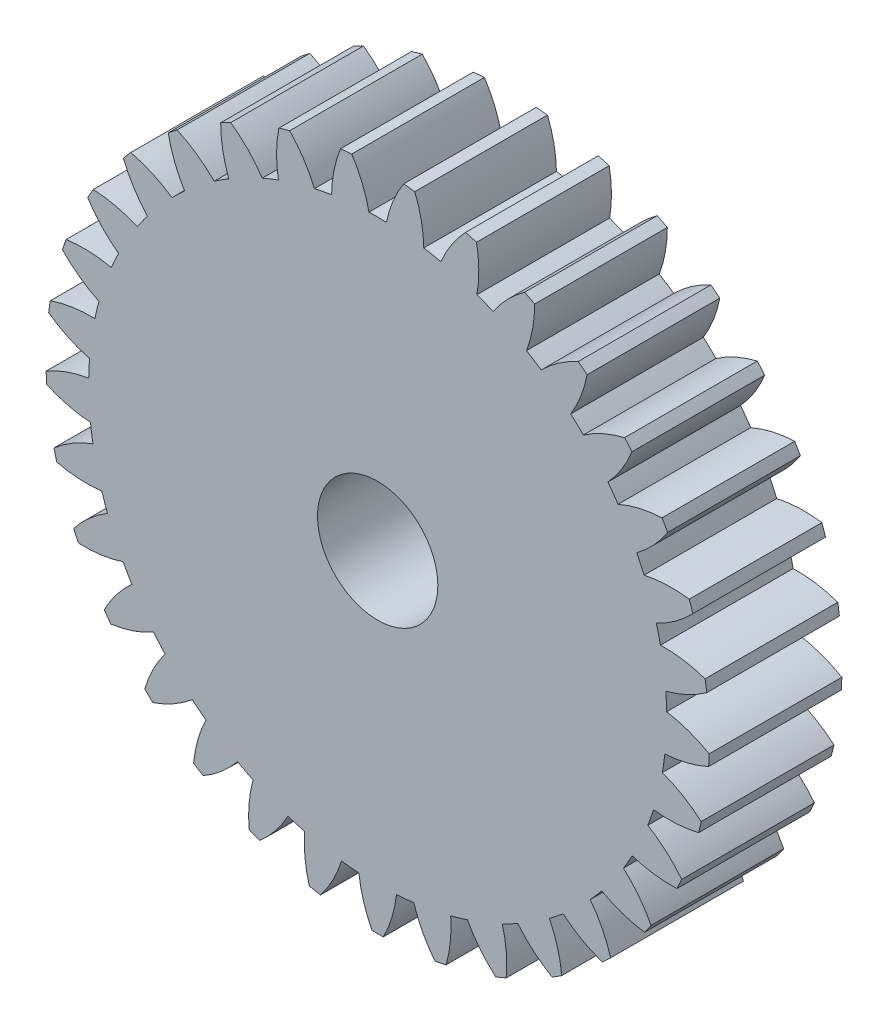
from build123d import *

# Parameters (mm, degrees)
CROQUIS1_R              = 3.175
SALIENTE_EXTRUIR1_DEPTH = 7


with BuildPart() as part:
    # Croquis1 → Saliente-Extruir1 (new body)
    with BuildSketch(Plane.XY):
        with BuildLine():
            ThreePointArc((2.432853295, 15.05367815), (2.30290802, 16.243278252), (1.96029505, 17.389860359))
            ThreePointArc((1.96029505, 17.389860359), (1.663480758, 17.420758645), (1.366182748, 17.446591206))
            ThreePointArc((1.366182748, 17.446591206), (0.812769149, 16.385569262), (0.460038855, 15.242059088))
            ThreePointArc((0.460038855, 15.242059088), (0, 15.249), (-0.460038855, 15.242059088))
            ThreePointArc((-0.460038855, 15.242059088), (-0.812769149, 16.385569262), (-1.366182748, 17.446591206))
            ThreePointArc((-1.366182748, 17.446591206), (-1.663480758, 17.420758645), (-1.96029505, 17.389860359))
            ThreePointArc((-1.96029505, 17.389860359), (-2.30290802, 16.243278252), (-2.432853295, 15.05367815))
            ThreePointArc((-2.432853295, 15.05367815), (-2.885892225, 14.973430705), (-3.336304003, 14.879552298))
            ThreePointArc((-3.336304003, 14.879552298), (-3.899070724, 15.935643106), (-4.643283141, 16.872756789))
            ThreePointArc((-4.643283141, 16.872756789), (-4.930319745, 16.791127038), (-5.215922677, 16.704614651))
            ThreePointArc((-5.215922677, 16.704614651), (-5.335352094, 15.513912845), (-5.237815789, 14.321218061))
            ThreePointArc((-5.237815789, 14.321218061), (-5.667480786, 14.156682611), (-6.091986431, 13.97925972))
            ThreePointArc((-6.091986431, 13.97925972), (-6.844449724, 14.909761289), (-7.752563184, 15.689096981))
            ThreePointArc((-7.752563184, 15.689096981), (-8.01896413, 15.554620351), (-8.283033268, 15.415620645))
            ThreePointArc((-8.283033268, 15.415620645), (-8.174962642, 14.223834206), (-7.853469973, 13.071151838))
            ThreePointArc((-7.853469973, 13.071151838), (-8.244231825, 12.828275122), (-8.627488597, 12.573720273))
            ThreePointArc((-8.627488597, 12.573720273), (-9.542452478, 13.345001851), (-10.581645394, 13.93839233))
            ThreePointArc((-10.581645394, 13.93839233), (-10.817782259, 13.755929158), (-11.050773456, 13.569465945))
            ThreePointArc((-11.050773456, 13.569465945), (-10.71910874, 12.41966914), (-10.18527929, 11.348660131))
            ThreePointArc((-10.18527929, 11.348660131), (-10.523014846, 11.036220347), (-10.851170847, 10.713733815))
            ThreePointArc((-10.851170847, 10.713733815), (-11.895566137, 11.297919277), (-13.02827937, 11.683917864))
            ThreePointArc((-13.02827937, 11.683917864), (-13.225617551, 11.460062844), (-13.419109899, 11.23287539))
            ThreePointArc((-13.419109899, 11.23287539), (-12.87583832, 10.166624871), (-12.148966076, 9.215998279))
            ThreePointArc((-12.148966076, 9.215998279), (-12.421468693, 8.845287814), (-12.68266351, 8.466525102))
            ThreePointArc((-12.68266351, 8.466525102), (-13.818743042, 8.842500464), (-15.004037384, 9.007156165))
            ThreePointArc((-15.004037384, 9.007156165), (-15.155444566, 8.75), (-15.302444747, 8.490299451))
            ThreePointArc((-15.302444747, 8.490299451), (-14.567201556, 7.546132291), (-13.673557575, 6.750246236))
            ThreePointArc((-13.673557575, 6.750246236), (-13.870978297, 6.334663533), (-14.055771669, 5.913314113))
            ThreePointArc((-14.055771669, 5.913314113), (-15.242474569, 6.067490645), (-16.437510395, 6.004852374))
            ThreePointArc((-16.437510395, 6.004852374), (-16.537514328, 5.723689358), (-16.632709371, 5.44086197))
            ThreePointArc((-16.632709371, 5.44086197), (-15.732068173, 4.652902829), (-14.703951076, 4.040522707))
            ThreePointArc((-14.703951076, 4.040522707), (-14.819154605, 3.595088008), (-14.920867618, 3.146380544))
            ThreePointArc((-14.920867618, 3.146380544), (-16.115303351, 3.073185905), (-17.276888952, 2.785517572))
            ThreePointArc((-17.276888952, 2.785517572), (-17.321875233, 2.49050967), (-17.361824543, 2.19477756))
            ThreePointArc((-17.361824543, 2.19477756), (-16.328336856, 1.591505335), (-15.202905475, 1.18476416))
            ThreePointArc((-15.202905475, 1.18476416), (-15.231728055, 0.725576634), (-15.246684535, 0.265728585))
            ThreePointArc((-15.246684535, 0.265728585), (-16.405683083, -0.03219178), (-17.491835728, -0.534493092))
            ThreePointArc((-17.491835728, -0.534493092), (-17.480178436, -0.832683527), (-17.46343814, -1.130631829))
            ThreePointArc((-17.46343814, -1.130631829), (-16.334456903, -1.527413308), (-15.152387259, -1.713814851))
            ThreePointArc((-15.152387259, -1.713814851), (-15.093787167, -2.170158969), (-15.021446549, -2.624527497))
            ThreePointArc((-15.021446549, -2.624527497), (-16.103118683, -3.136405971), (-17.074581986, -3.835185783))
            ThreePointArc((-17.074581986, -3.835185783), (-17.006702446, -4.125781371), (-16.933877582, -4.415177237))
            ThreePointArc((-16.933877582, -4.415177237), (-15.750207118, -4.591127255), (-14.554222289, -4.550452128))
            ThreePointArc((-14.554222289, -4.550452128), (-14.410317485, -4.987459373), (-14.253294346, -5.419926318))
            ThreePointArc((-14.253294346, -5.419926318), (-15.218545617, -6.127262278), (-16.040208364, -6.997264868))
            ThreePointArc((-16.040208364, -6.997264868), (-15.918559919, -7.269762728), (-15.792282567, -7.540146637))
            ThreePointArc((-15.792282567, -7.540146637), (-14.596703811, -7.4889059), (-13.430029804, -7.222624209))
            ThreePointArc((-13.430029804, -7.222624209), (-13.206021382, -7.6245), (-12.969990949, -8.01943488))
            ThreePointArc((-12.969990949, -8.01943488), (-13.783934661, -8.896663362), (-14.42609982, -9.906444569))
            ThreePointArc((-14.42609982, -9.906444569), (-14.255079161, -10.150995918), (-14.079913315, -10.392595492))
            ThreePointArc((-14.079913315, -10.392595492), (-12.915637597, -10.116015974), (-11.820441051, -9.633751832))
            ThreePointArc((-11.820441051, -9.633751832), (-11.524425259, -9.985971332), (-11.217918286, -10.32910017))
            ThreePointArc((-11.217918286, -10.32910017), (-11.851136393, -11.344515851), (-12.290594441, -12.457579552))
            ThreePointArc((-12.290594441, -12.457579552), (-12.076382701, -12.665345667), (-11.85865931, -12.869428868))
            ThreePointArc((-11.85865931, -12.869428868), (-10.767766589, -12.377506874), (-9.78363076, -11.696690564))
            ThreePointArc((-9.78363076, -11.696690564), (-9.426306381, -11.986523642), (-9.060400828, -12.265444869))
            ThreePointArc((-9.060400828, -12.265444869), (-9.490007178, -13.382347981), (-9.710874956, -14.558465152))
            ThreePointArc((-9.710874956, -14.558465152), (-9.461214305, -14.721936825), (-9.20880246, -14.881127553))
            ThreePointArc((-9.20880246, -14.881127553), (-8.230720441, -14.191642426), (-7.393214562, -13.336880424))
            ThreePointArc((-7.393214562, -13.336880424), (-6.98749623, -13.553851757), (-6.575416878, -13.758484433))
            ThreePointArc((-6.575416878, -13.758484433), (-6.785884378, -14.936507186), (-6.780179149, -16.13316989))
            ThreePointArc((-6.780179149, -16.13316989), (-6.504092974, -16.246438828), (-6.226115496, -16.354983517))
            ThreePointArc((-6.226115496, -16.354983517), (-5.396194611, -15.492855045), (-4.735588328, -14.495040676))
            ThreePointArc((-4.735588328, -14.495040676), (-4.296139759, -14.631308355), (-3.852780229, -14.754256522))
            ThreePointArc((-3.852780229, -14.754256522), (-3.836502035, -15.950822106), (-3.604430001, -17.124779834))
            ThreePointArc((-3.604430001, -17.124779834), (-3.311896776, -17.183752202), (-3.018400496, -17.237727764))
            ThreePointArc((-3.018400496, -17.237727764), (-2.366636249, -16.234115516), (-1.906805592, -15.129312391))
            ThreePointArc((-1.906805592, -15.129312391), (-1.449509604, -15.179951347), (-0.990894065, -15.216771338))
            ThreePointArc((-0.990894065, -15.216771338), (-0.748458514, -16.388632755), (-0.298407363, -17.497455616))
            ThreePointArc((-0.298407363, -17.497455616), (0, -17.5), (0.298407363, -17.497455616))
            ThreePointArc((0.298407363, -17.497455616), (0.748458514, -16.388632755), (0.990894065, -15.216771338))
            ThreePointArc((0.990894065, -15.216771338), (1.449509604, -15.179951347), (1.906805592, -15.129312391))
            ThreePointArc((1.906805592, -15.129312391), (2.366636249, -16.234115516), (3.018400496, -17.237727764))
            ThreePointArc((3.018400496, -17.237727764), (3.311896776, -17.183752202), (3.604430001, -17.124779834))
            ThreePointArc((3.604430001, -17.124779834), (3.836502035, -15.950822106), (3.852780229, -14.754256522))
            ThreePointArc((3.852780229, -14.754256522), (4.296139759, -14.631308355), (4.735588328, -14.495040676))
            ThreePointArc((4.735588328, -14.495040676), (5.396194611, -15.492855045), (6.226115496, -16.354983517))
            ThreePointArc((6.226115496, -16.354983517), (6.504092974, -16.246438828), (6.780179149, -16.13316989))
            ThreePointArc((6.780179149, -16.13316989), (6.785884378, -14.936507186), (6.575416878, -13.758484433))
            ThreePointArc((6.575416878, -13.758484433), (6.98749623, -13.553851757), (7.393214562, -13.336880424))
            ThreePointArc((7.393214562, -13.336880424), (8.230720441, -14.191642426), (9.20880246, -14.881127553))
            ThreePointArc((9.20880246, -14.881127553), (9.461214305, -14.721936825), (9.710874956, -14.558465152))
            ThreePointArc((9.710874956, -14.558465152), (9.490007178, -13.382347981), (9.060400828, -12.265444869))
            ThreePointArc((9.060400828, -12.265444869), (9.426306381, -11.986523642), (9.78363076, -11.696690564))
            ThreePointArc((9.78363076, -11.696690564), (10.767766589, -12.377506874), (11.85865931, -12.869428868))
            ThreePointArc((11.85865931, -12.869428868), (12.076382701, -12.665345667), (12.290594441, -12.457579552))
            ThreePointArc((12.290594441, -12.457579552), (11.851136393, -11.344515851), (11.217918286, -10.32910017))
            ThreePointArc((11.217918286, -10.32910017), (11.524425259, -9.985971332), (11.820441051, -9.633751832))
            ThreePointArc((11.820441051, -9.633751832), (12.915637597, -10.116015974), (14.079913315, -10.392595492))
            ThreePointArc((14.079913315, -10.392595492), (14.255079161, -10.150995918), (14.42609982, -9.906444569))
            ThreePointArc((14.42609982, -9.906444569), (13.783934661, -8.896663362), (12.969990949, -8.01943488))
            ThreePointArc((12.969990949, -8.01943488), (13.206021382, -7.6245), (13.430029804, -7.222624209))
            ThreePointArc((13.430029804, -7.222624209), (14.596703811, -7.4889059), (15.792282567, -7.540146637))
            ThreePointArc((15.792282567, -7.540146637), (15.918559919, -7.269762728), (16.040208364, -6.997264868))
            ThreePointArc((16.040208364, -6.997264868), (15.218545617, -6.127262278), (14.253294346, -5.419926318))
            ThreePointArc((14.253294346, -5.419926318), (14.410317485, -4.987459373), (14.554222289, -4.550452128))
            ThreePointArc((14.554222289, -4.550452128), (15.750207118, -4.591127255), (16.933877582, -4.415177237))
            ThreePointArc((16.933877582, -4.415177237), (17.006702446, -4.125781371), (17.074581986, -3.835185783))
            ThreePointArc((17.074581986, -3.835185783), (16.103118683, -3.136405971), (15.021446549, -2.624527497))
            ThreePointArc((15.021446549, -2.624527497), (15.093787167, -2.170158969), (15.152387259, -1.713814851))
            ThreePointArc((15.152387259, -1.713814851), (16.334456903, -1.527413308), (17.46343814, -1.130631829))
            ThreePointArc((17.46343814, -1.130631829), (17.480178436, -0.832683527), (17.491835728, -0.534493092))
            ThreePointArc((17.491835728, -0.534493092), (16.405683083, -0.03219178), (15.246684535, 0.265728585))
            ThreePointArc((15.246684535, 0.265728585), (15.231728055, 0.725576634), (15.202905475, 1.18476416))
            ThreePointArc((15.202905475, 1.18476416), (16.328336856, 1.591505335), (17.361824543, 2.19477756))
            ThreePointArc((17.361824543, 2.19477756), (17.321875233, 2.49050967), (17.276888952, 2.785517572))
            ThreePointArc((17.276888952, 2.785517572), (16.115303351, 3.073185905), (14.920867618, 3.146380544))
            ThreePointArc((14.920867618, 3.146380544), (14.819154605, 3.595088008), (14.703951076, 4.040522707))
            ThreePointArc((14.703951076, 4.040522707), (15.732068173, 4.652902829), (16.632709371, 5.44086197))
            ThreePointArc((16.632709371, 5.44086197), (16.537514328, 5.723689358), (16.437510395, 6.004852374))
            ThreePointArc((16.437510395, 6.004852374), (15.242474569, 6.067490645), (14.055771669, 5.913314113))
            ThreePointArc((14.055771669, 5.913314113), (13.870978297, 6.334663533), (13.673557575, 6.750246236))
            ThreePointArc((13.673557575, 6.750246236), (14.567201556, 7.546132291), (15.302444747, 8.490299451))
            ThreePointArc((15.302444747, 8.490299451), (15.155444566, 8.75), (15.004037384, 9.007156165))
            ThreePointArc((15.004037384, 9.007156165), (13.818743042, 8.842500464), (12.68266351, 8.466525102))
            ThreePointArc((12.68266351, 8.466525102), (12.421468693, 8.845287814), (12.148966076, 9.215998279))
            ThreePointArc((12.148966076, 9.215998279), (12.87583832, 10.166624871), (13.419109899, 11.23287539))
            ThreePointArc((13.419109899, 11.23287539), (13.225617551, 11.460062844), (13.02827937, 11.683917864))
            ThreePointArc((13.02827937, 11.683917864), (11.895566137, 11.297919277), (10.851170847, 10.713733815))
            ThreePointArc((10.851170847, 10.713733815), (10.523014846, 11.036220347), (10.18527929, 11.348660131))
            ThreePointArc((10.18527929, 11.348660131), (10.71910874, 12.41966914), (11.050773456, 13.569465945))
            ThreePointArc((11.050773456, 13.569465945), (10.817782259, 13.755929158), (10.581645394, 13.93839233))
            ThreePointArc((10.581645394, 13.93839233), (9.542452478, 13.345001851), (8.627488597, 12.573720273))
            ThreePointArc((8.627488597, 12.573720273), (8.244231825, 12.828275122), (7.853469973, 13.071151838))
            ThreePointArc((7.853469973, 13.071151838), (8.174962642, 14.223834206), (8.283033268, 15.415620645))
            ThreePointArc((8.283033268, 15.415620645), (8.01896413, 15.554620351), (7.752563184, 15.689096981))
            ThreePointArc((7.752563184, 15.689096981), (6.844449724, 14.909761289), (6.091986431, 13.97925972))
            ThreePointArc((6.091986431, 13.97925972), (5.667480786, 14.156682611), (5.237815789, 14.321218061))
            ThreePointArc((5.237815789, 14.321218061), (5.335352094, 15.513912845), (5.215922677, 16.704614651))
            ThreePointArc((5.215922677, 16.704614651), (4.930319745, 16.791127038), (4.643283141, 16.872756789))
            ThreePointArc((4.643283141, 16.872756789), (3.899070724, 15.935643106), (3.336304003, 14.879552298))
            ThreePointArc((3.336304003, 14.879552298), (2.885892225, 14.973430705), (2.432853295, 15.05367815))
        make_face()
        Circle(CROQUIS1_R, mode=Mode.SUBTRACT)
    extrude(amount=SALIENTE_EXTRUIR1_DEPTH)


solid = part.part
